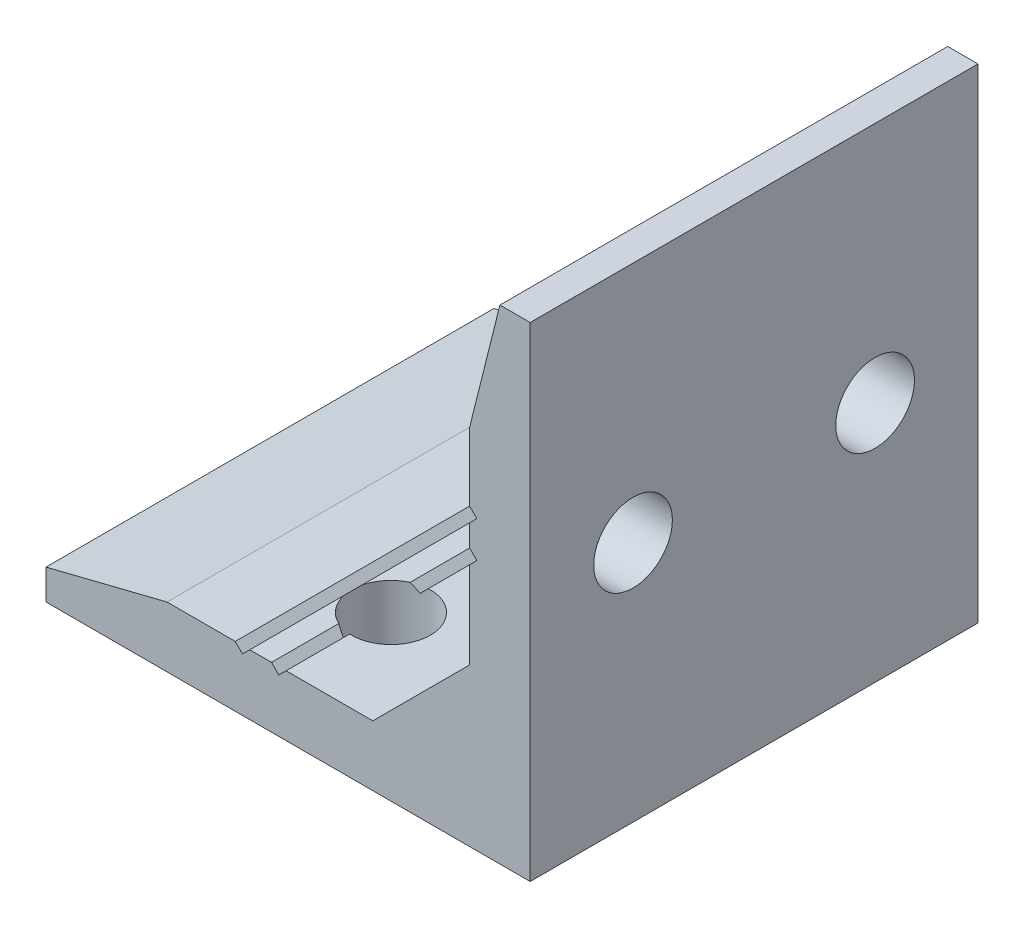
from build123d import *

# Parameters (mm, degrees)
EXTRUDE_1_DEPTH     = 18.5
SKETCH_3_R          = 3.25
CUT_EXTRUDE_1_DEPTH = 57.278326201


with BuildPart() as part:
    # 草图1 → 凸台-拉伸1 (new, symmetric)
    with BuildSketch(Plane.XY):
        Polygon((0, 0), (40, 0), (40, 40), (37.5, 40), (35, 30), (35, 24.364950833), (35.6, 23.764950833), (35, 23.164950833), (35, 21.364950833), (35.6, 20.764950833), (35, 20.164950833), (35, 13), (27, 5), (19.835049167, 5), (19.235049167, 4.4), (18.635049167, 5), (16.835049167, 5), (16.235049167, 4.4), (15.635049167, 5), (10, 5), (0, 2.5), align=None)
    extrude(amount=EXTRUDE_1_DEPTH, both=True)

    # 草图3 → 切除-拉伸1 (cut, through all)
    with BuildSketch(Plane(origin=(0, 5, 0), x_dir=(1, 0, 0), z_dir=(0, 1, 0))):
        with Locations(Location((20, 10, 0), (0, 0, 270))):
            Circle(SKETCH_3_R)
        with Locations(Location((20, -10, 0), (0, 0, 267.090754189))):
            Circle(SKETCH_3_R)
    cut_extrude_1 = extrude(amount=-CUT_EXTRUDE_1_DEPTH, mode=Mode.SUBTRACT)

    # 镜向1: 切除-拉伸1 across plane
    add(cut_extrude_1.mirror(Plane(origin=(20, 20, 0), x_dir=(0, 0, 1), z_dir=(0.707106781186541, 0.707106781186554, 0))), mode=Mode.SUBTRACT)


solid = part.part
